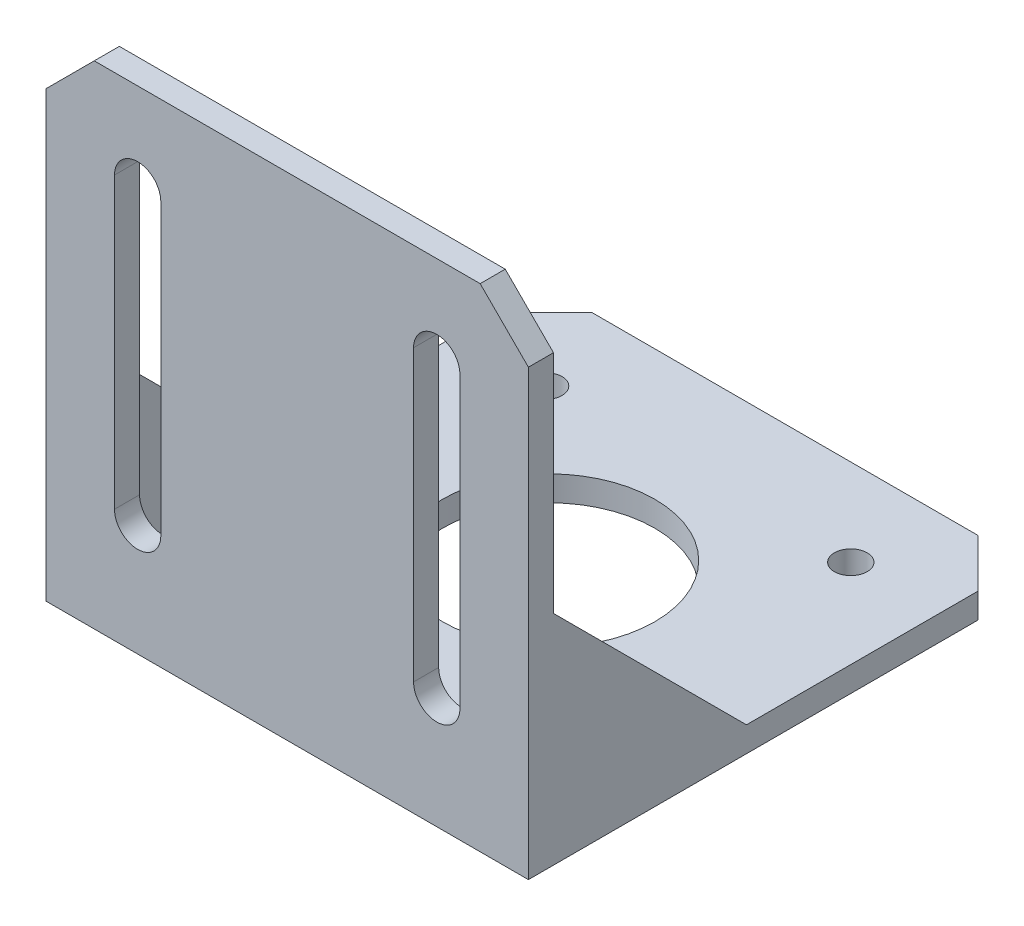
from build123d import *

# Parameters (mm, degrees)
SKETCH1_W           = 50
SKETCH1_H           = 49
SKETCH1_R           = 1.7
SKETCH1_R_2         = 11
BOSS_EXTRUDE1_DEPTH = 2.6
SKETCH2_W           = 50
SKETCH2_H           = 51
BOSS_EXTRUDE2_DEPTH = 2.6
BOSS_EXTRUDE3_DEPTH = 2.6
CHAMFER1_SIZE       = 5
CHAMFER2_SIZE       = 0.4


with BuildPart() as part:
    # Sketch1 → Boss-Extrude1 (new body)
    with BuildSketch(Plane(origin=(0, 0, 0), x_dir=(1, 0, 0), z_dir=(0, 1, 0))):
        Rectangle(SKETCH1_W, SKETCH1_H)
        with Locations(Location((-15.816326531, 15.5, 0), (0, 0, 270))):
            Circle(SKETCH1_R, mode=Mode.SUBTRACT)
        with Locations(Location((15.816326531, 15.5, 0), (0, 0, 270))):
            Circle(SKETCH1_R, mode=Mode.SUBTRACT)
        with Locations(Location((-15.816326531, -15.5, 0), (0, 0, 270))):
            Circle(SKETCH1_R, mode=Mode.SUBTRACT)
        with Locations(Location((15.816326531, -15.5, 0), (0, 0, 270))):
            Circle(SKETCH1_R, mode=Mode.SUBTRACT)
        with Locations(Location((0, 0, 0), (0, 0, 270))):
            Circle(SKETCH1_R_2, mode=Mode.SUBTRACT)
    extrude(amount=BOSS_EXTRUDE1_DEPTH)

    # Sketch2 → Boss-Extrude2 (add)
    with BuildSketch(Plane.XY.offset(24.5)):
        with Locations((0, 25.5)):
            Rectangle(SKETCH2_W, SKETCH2_H)
        with BuildLine():
            Line((-13.1, 41.8), (-13.1, 11.8))
            ThreePointArc((-13.1, 11.8), (-15.5, 9.4), (-17.9, 11.8))
            Line((-17.9, 11.8), (-17.9, 41.8))
            ThreePointArc((-17.9, 41.8), (-15.5, 44.2), (-13.1, 41.8))
        make_face(mode=Mode.SUBTRACT)
        with BuildLine():
            Line((13.1, 41.8), (13.1, 11.8))
            ThreePointArc((13.1, 11.8), (15.5, 9.4), (17.9, 11.8))
            Line((17.9, 11.8), (17.9, 41.8))
            ThreePointArc((17.9, 41.8), (15.5, 44.2), (13.1, 41.8))
        make_face(mode=Mode.SUBTRACT)
    extrude(amount=BOSS_EXTRUDE2_DEPTH)

    # Sketch3 → Boss-Extrude3 (add)
    with BuildSketch(Plane.ZY.offset(25)):
        Polygon((4.5, 2.6), (24.5, 22.6), (24.5, 2.6), align=None)
    boss_extrude3 = extrude(amount=-BOSS_EXTRUDE3_DEPTH)

    # Mirror1: Boss-Extrude3 across plane
    add(boss_extrude3.mirror(Plane(origin=(0, 0, 0), x_dir=(0, 0, 1), z_dir=(1, 0, 0))))

    # Chamfer1
    chamfer1_edges = [part.edges().sort_by_distance(p)[0] for p in [
        (-25, 51, 25.8),
        (25, 51, 25.8),
        (-25, 1.3, -24.5),
        (25, 1.3, -24.5),
    ]]
    chamfer(chamfer1_edges, length=CHAMFER1_SIZE)

    # Chamfer2
    chamfer2_edges = [part.edges().sort_by_distance(p)[0] for p in [
        (0, 2.6, 24.5),
    ]]
    chamfer(chamfer2_edges, length=CHAMFER2_SIZE)


solid = part.part
